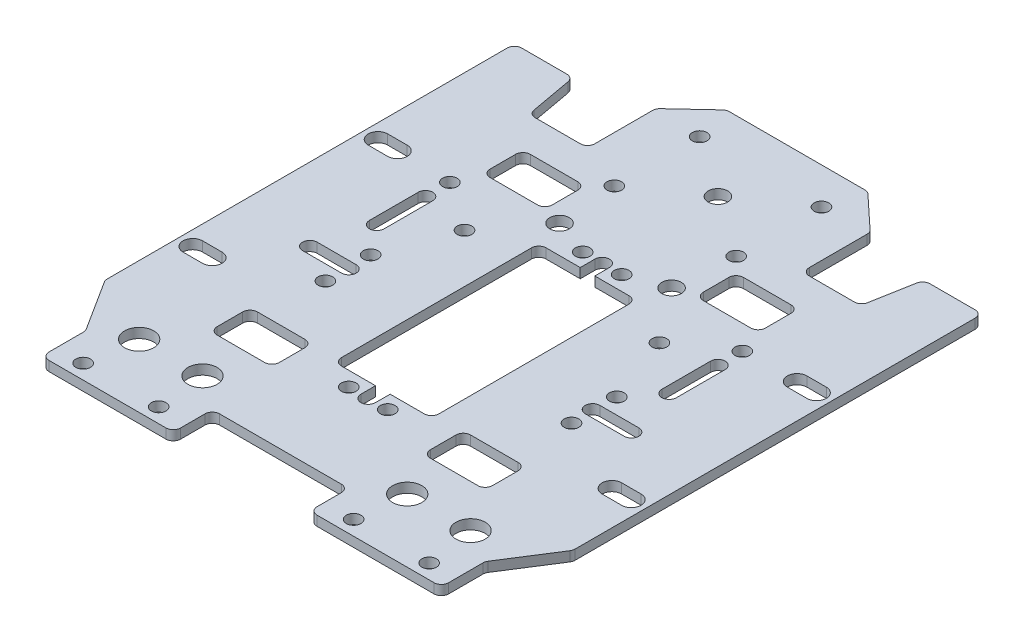
from build123d import *

# Parameters (mm, degrees)
SKETCH1_R           = 1.5
SKETCH1_R_2         = 3
SKETCH1_R_3         = 2
SKETCH1_W           = 12.75
SKETCH1_H           = 8.25
BOSS_EXTRUDE1_DEPTH = 2
FILLET1_R           = 1.5


with BuildPart() as part:
    # Sketch1 → Boss-Extrude1 (new body)
    with BuildSketch(Plane(origin=(0, 0, 0), x_dir=(1, 0, 0), z_dir=(0, 1, 0))):
        Polygon((0, 20), (0, 104), (12, 104), (14, 93), (26, 93), (26, 107), (33.5, 114), (62.5, 114), (70, 107), (70, 93), (82, 93), (84, 104), (96, 104), (96, 20), (89, 9), (89, 0), (62, 0), (62, 8), (34, 8), (34, 0), (7, 0), (7, 9), align=None)
        with Locations(Location((12.5, 3, 0), (0, 0, 270))):
            Circle(SKETCH1_R, mode=Mode.SUBTRACT)
        with Locations(Location((28, 3, 0), (0, 0, 270))):
            Circle(SKETCH1_R, mode=Mode.SUBTRACT)
        with Locations(Location((68, 3, 0), (0, 0, 90))):
            Circle(SKETCH1_R, mode=Mode.SUBTRACT)
        with Locations(Location((83.5, 3, 0), (0, 0, 90))):
            Circle(SKETCH1_R, mode=Mode.SUBTRACT)
        with Locations(Location((14, 13, 0), (0, 0, 270))):
            Circle(SKETCH1_R_2, mode=Mode.SUBTRACT)
        with Locations(Location((27, 13, 0), (0, 0, 270))):
            Circle(SKETCH1_R_2, mode=Mode.SUBTRACT)
        with Locations(Location((69, 13, 0), (0, 0, 90))):
            Circle(SKETCH1_R_2, mode=Mode.SUBTRACT)
        with Locations(Location((82, 13, 0), (0, 0, 90))):
            Circle(SKETCH1_R_2, mode=Mode.SUBTRACT)
        with Locations(Location((22.75, 42.455027657, 0), (0, 0, 270))):
            Circle(SKETCH1_R, mode=Mode.SUBTRACT)
        with Locations(Location((22.75, 51.751081058, 0), (0, 0, 270))):
            Circle(SKETCH1_R, mode=Mode.SUBTRACT)
        with Locations(Location((73.25, 42.455027657, 0), (0, 0, 90))):
            Circle(SKETCH1_R, mode=Mode.SUBTRACT)
        with Locations(Location((73.25, 51.751081058, 0), (0, 0, 90))):
            Circle(SKETCH1_R, mode=Mode.SUBTRACT)
        with Locations(Location((18, 72.75, 0), (0, 0, 270))):
            Circle(SKETCH1_R, mode=Mode.SUBTRACT)
        with Locations(Location((28, 65.75, 0), (0, 0, 270))):
            Circle(SKETCH1_R, mode=Mode.SUBTRACT)
        with Locations(Location((68, 65.75, 0), (0, 0, 90))):
            Circle(SKETCH1_R, mode=Mode.SUBTRACT)
        with Locations(Location((78, 72.75, 0), (0, 0, 90))):
            Circle(SKETCH1_R, mode=Mode.SUBTRACT)
        with Locations(Location((36.5, 76.75, 0), (0, 0, 270))):
            Circle(SKETCH1_R_3, mode=Mode.SUBTRACT)
        with Locations(Location((59.5, 76.75, 0), (0, 0, 90))):
            Circle(SKETCH1_R_3, mode=Mode.SUBTRACT)
        with Locations(Location((35.5, 89, 0), (0, 0, 270))):
            Circle(SKETCH1_R, mode=Mode.SUBTRACT)
        with Locations(Location((35.5, 106.5, 0), (0, 0, 270))):
            Circle(SKETCH1_R, mode=Mode.SUBTRACT)
        with Locations(Location((60.5, 89, 0), (0, 0, 90))):
            Circle(SKETCH1_R, mode=Mode.SUBTRACT)
        with Locations(Location((60.5, 106.5, 0), (0, 0, 90))):
            Circle(SKETCH1_R, mode=Mode.SUBTRACT)
        with Locations(Location((44, 26, 0), (0, 0, 270))):
            Circle(SKETCH1_R, mode=Mode.SUBTRACT)
        with Locations(Location((52, 26, 0), (0, 0, 90))):
            Circle(SKETCH1_R, mode=Mode.SUBTRACT)
        with Locations(Location((52, 74, 0), (0, 0, 270))):
            Circle(SKETCH1_R, mode=Mode.SUBTRACT)
        with Locations(Location((44, 74, 0), (0, 0, 90))):
            Circle(SKETCH1_R, mode=Mode.SUBTRACT)
        with Locations(Location((48, 97.75, 0), (0, 0, 270))):
            Circle(SKETCH1_R_3, mode=Mode.SUBTRACT)
        with Locations((69.875, 25.875)):
            Rectangle(SKETCH1_W, SKETCH1_H, mode=Mode.SUBTRACT)
        with Locations((26.125, 25.875)):
            Rectangle(SKETCH1_W, SKETCH1_H, mode=Mode.SUBTRACT)
        with Locations((69.875, 81.875)):
            Rectangle(SKETCH1_W, SKETCH1_H, mode=Mode.SUBTRACT)
        with Locations((26.125, 81.875)):
            Rectangle(SKETCH1_W, SKETCH1_H, mode=Mode.SUBTRACT)
        with BuildLine():
            Line((3, 75), (7, 75))
            ThreePointArc((7, 75), (9, 73), (7, 71))
            Line((7, 71), (3, 71))
            ThreePointArc((3, 71), (1, 73), (3, 75))
        make_face(mode=Mode.SUBTRACT)
        with BuildLine():
            Line((93, 75), (89, 75))
            ThreePointArc((89, 75), (87, 73), (89, 71))
            Line((89, 71), (93, 71))
            ThreePointArc((93, 71), (95, 73), (93, 75))
        make_face(mode=Mode.SUBTRACT)
        with BuildLine():
            Line((93, 37), (89, 37))
            ThreePointArc((89, 37), (87, 35), (89, 33))
            Line((89, 33), (93, 33))
            ThreePointArc((93, 33), (95, 35), (93, 37))
        make_face(mode=Mode.SUBTRACT)
        with BuildLine():
            Line((3, 33), (7, 33))
            ThreePointArc((7, 33), (9, 35), (7, 37))
            Line((7, 37), (3, 37))
            ThreePointArc((3, 37), (1, 35), (3, 33))
        make_face(mode=Mode.SUBTRACT)
        with BuildLine():
            Line((15, 48.525154469), (23, 48.525154469))
            ThreePointArc((23, 48.525154469), (24.5, 47.025154469), (23, 45.525154469))
            Line((23, 45.525154469), (15, 45.525154469))
            ThreePointArc((15, 45.525154469), (13.5, 47.025154469), (15, 48.525154469))
        make_face(mode=Mode.SUBTRACT)
        with BuildLine():
            Line((81, 48.525154469), (73, 48.525154469))
            ThreePointArc((73, 48.525154469), (71.5, 47.025154469), (73, 45.525154469))
            Line((73, 45.525154469), (81, 45.525154469))
            ThreePointArc((81, 45.525154469), (82.5, 47.025154469), (81, 48.525154469))
        make_face(mode=Mode.SUBTRACT)
        with BuildLine():
            Line((16.5, 67.75), (16.5, 57.75))
            ThreePointArc((16.5, 57.75), (18, 56.25), (19.5, 57.75))
            Line((19.5, 57.75), (19.5, 67.75))
            ThreePointArc((19.5, 67.75), (18, 69.25), (16.5, 67.75))
        make_face(mode=Mode.SUBTRACT)
        with BuildLine():
            Line((76.5, 67.75), (76.5, 57.75))
            ThreePointArc((76.5, 57.75), (78, 56.25), (79.5, 57.75))
            Line((79.5, 57.75), (79.5, 67.75))
            ThreePointArc((79.5, 67.75), (78, 69.25), (76.5, 67.75))
        make_face(mode=Mode.SUBTRACT)
        with BuildLine():
            Line((46.5, 29), (38, 29))
            Line((38, 29), (38, 71))
            Line((38, 71), (46.5, 71))
            Line((46.5, 71), (46.5, 74))
            ThreePointArc((46.5, 74), (48, 75.5), (49.5, 74))
            Line((49.5, 74), (49.5, 71))
            Line((49.5, 71), (58, 71))
            Line((58, 71), (58, 29))
            Line((58, 29), (49.5, 29))
            Line((49.5, 29), (49.5, 26))
            ThreePointArc((49.5, 26), (48, 24.5), (46.5, 26))
            Line((46.5, 26), (46.5, 29))
        make_face(mode=Mode.SUBTRACT)
    extrude(amount=BOSS_EXTRUDE1_DEPTH)

    # Fillet1
    fillet1_edges = [part.edges().sort_by_distance(p)[0] for p in [
        (19.75, 1, -30),
        (19.75, 1, -21.75),
        (32.5, 1, -21.75),
        (32.5, 1, -30),
        (63.5, 1, -77.75),
        (76.25, 1, -77.75),
        (76.25, 1, -86),
        (63.5, 1, -86),
        (19.75, 1, -86),
        (19.75, 1, -77.75),
        (32.5, 1, -77.75),
        (32.5, 1, -86),
        (58, 1, -29),
        (58, 1, -71),
        (38, 1, -71),
        (38, 1, -29),
        (62, 1, -8),
        (34, 1, -8),
        (34, 1, 0),
        (7, 1, 0),
        (7, 1, -9),
        (0, 1, -20),
        (0, 1, -104),
        (12, 1, -104),
        (14, 1, -93),
        (26, 1, -93),
        (26, 1, -107),
        (33.5, 1, -114),
        (62.5, 1, -114),
        (70, 1, -107),
        (70, 1, -93),
        (82, 1, -93),
        (84, 1, -104),
        (96, 1, -104),
        (96, 1, -20),
        (89, 1, -9),
        (89, 1, 0),
        (62, 1, 0),
        (76.25, 1, -21.75),
        (76.25, 1, -30),
        (63.5, 1, -30),
        (63.5, 1, -21.75),
    ]]
    fillet(fillet1_edges, radius=FILLET1_R)


solid = part.part
